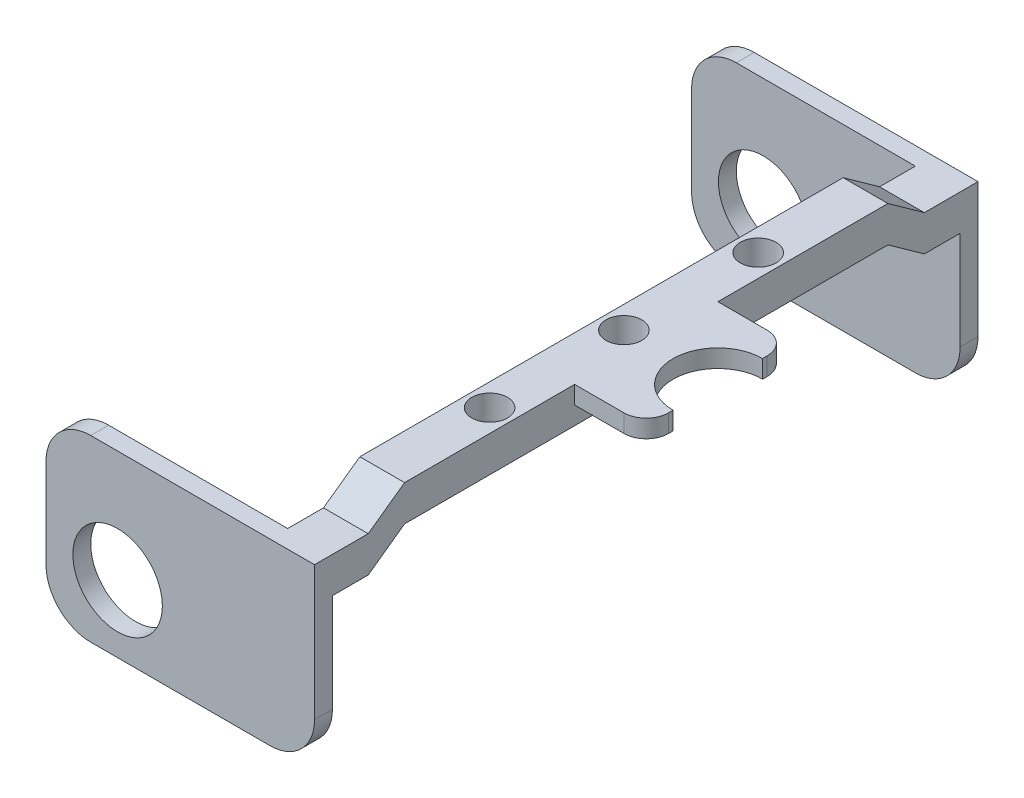
from build123d import *

# Parameters (mm, degrees)
SKETCH1_W            = 5
SKETCH1_H            = 54
BOSS_EXTRUDE1_DEPTH  = 4
SKETCH3_W            = 16
SKETCH3_H            = 16
BOSS_EXTRUDE2_DEPTH  = 4
SKETCH6_W            = 5
SKETCH6_H            = 4
BOSS_EXTRUDE5_DEPTH  = 5
SKETCH10_W           = 30
SKETCH10_H           = 20
BOSS_EXTRUDE9_DEPTH  = 6
CUT_EXTRUDE2_REACH   = 54.903
SKETCH7_R            = 2
CUT_EXTRUDE3_REACH   = 54.903
SKETCH4_R            = 5
SKETCH12_W           = 16
SKETCH12_H           = 16
CUT_EXTRUDE4_DEPTH   = 2
CUT_EXTRUDE5_DEPTH   = 4
CUT_EXTRUDE6_REACH   = 78.804
SKETCH14_R           = 5
FILLET1_R            = 5
FILLET1_OF_MIRROR2_R = 5
CUT_EXTRUDE7_REACH   = 54.903
FILLET2_R            = 2.5


with BuildPart() as part:
    # Sketch1 → Boss-Extrude1 (new body)
    with BuildSketch(Plane(origin=(0, 0, 0), x_dir=(1, 0, 0), z_dir=(0, 1, 0))):
        with Locations((-2.5, 0)):
            Rectangle(SKETCH1_W, SKETCH1_H)
    extrude(amount=BOSS_EXTRUDE1_DEPTH)

    # Sketch3 → Boss-Extrude2 (add)
    with BuildSketch(Plane(origin=(0, 0, 0), x_dir=(1, 0, 0), z_dir=(0, 1, 0))):
        with Locations((8, 0)):
            Rectangle(SKETCH3_W, SKETCH3_H)
    extrude(amount=BOSS_EXTRUDE2_DEPTH)

    # Sketch6 → Boss-Extrude5 (add, along a direction that is not the sketch's normal)
    with BuildSketch(Plane.XY.offset(27)):
        with Locations((-2.5, 2)):
            Rectangle(SKETCH6_W, SKETCH6_H)
    boss_extrude5 = extrude(amount=BOSS_EXTRUDE5_DEPTH, dir=(0, -0.5827823156195225, 0.8126283114691164))

    # Mirror1: Boss-Extrude5 across plane
    add(boss_extrude5.mirror(Plane.XY))

    # Sketch10 → Boss-Extrude9 (add)
    with BuildSketch(Plane.XY.offset(31.063141557)):
        with Locations((-15, -8.913911578)):
            Rectangle(SKETCH10_W, SKETCH10_H)
    boss_extrude9 = extrude(amount=BOSS_EXTRUDE9_DEPTH)

    # Sketch7 → Cut-Extrude2 (cut, up to next)
    with BuildSketch(Plane(origin=(0, 4, 0), x_dir=(1, 0, 0), z_dir=(0, 1, 0)), mode=Mode.PRIVATE) as cut_extrude2_sk1:
        with Locations(Location((-2.5, 0, 0), (0, 0, 270))):
            Circle(SKETCH7_R)
    cut_extrude2_tool1 = extrude(cut_extrude2_sk1.sketch, amount=-CUT_EXTRUDE2_REACH, mode=Mode.PRIVATE) & part.part
    # Sketch7 → Cut-Extrude2 (cut, up to next)
    with BuildSketch(Plane(origin=(0, 4, 0), x_dir=(1, 0, 0), z_dir=(0, 1, 0)), mode=Mode.PRIVATE) as cut_extrude2_sk2:
        with Locations(Location((-2.5, 15, 0), (0, 0, 270))):
            Circle(SKETCH7_R)
    cut_extrude2_tool2 = extrude(cut_extrude2_sk2.sketch, amount=-CUT_EXTRUDE2_REACH, mode=Mode.PRIVATE) & part.part
    # Sketch7 → Cut-Extrude2 (cut, up to next)
    with BuildSketch(Plane(origin=(0, 4, 0), x_dir=(1, 0, 0), z_dir=(0, 1, 0)), mode=Mode.PRIVATE) as cut_extrude2_sk3:
        with Locations(Location((-2.5, -15, 0), (0, 0, 270))):
            Circle(SKETCH7_R)
    cut_extrude2_tool3 = extrude(cut_extrude2_sk3.sketch, amount=-CUT_EXTRUDE2_REACH, mode=Mode.PRIVATE) & part.part
    add(cut_extrude2_tool1.solids().sort_by_distance((-2.5, 4, 0))[0], mode=Mode.SUBTRACT)
    add(cut_extrude2_tool2.solids().sort_by_distance((-2.5, 4, -15))[0], mode=Mode.SUBTRACT)
    add(cut_extrude2_tool3.solids().sort_by_distance((-2.5, 4, 15))[0], mode=Mode.SUBTRACT)

    # Sketch4 → Cut-Extrude3 (cut, up to next)
    with BuildSketch(Plane(origin=(0, 4, 0), x_dir=(1, 0, 0), z_dir=(0, 1, 0)), mode=Mode.PRIVATE) as cut_extrude3_sk1:
        with Locations(Location((8, 0, 0), (0, 0, 270))):
            Circle(SKETCH4_R)
    cut_extrude3_tool1 = extrude(cut_extrude3_sk1.sketch, amount=-CUT_EXTRUDE3_REACH, mode=Mode.PRIVATE) & part.part
    add(cut_extrude3_tool1.solids().sort_by_distance((8, 4, 0))[0], mode=Mode.SUBTRACT)

    # Sketch12 → Cut-Extrude4 (cut)
    with BuildSketch(Plane.XZ):
        with Locations((8, 0)):
            Rectangle(SKETCH12_W, SKETCH12_H)
    extrude(amount=-CUT_EXTRUDE4_DEPTH, mode=Mode.SUBTRACT)

    # Sketch13 → Cut-Extrude5 (cut)
    with BuildSketch(Plane(origin=(0, 0, 31.063141557), x_dir=(-1, 0, 0), z_dir=(0, 0, -1))):
        Polygon((30, 1.086088422), (5, 1.086088422), (5, -2.913911578), (0, -2.913911578), (0, -18.913911578), (30, -18.913911578), align=None)
    cut_extrude5 = extrude(amount=-CUT_EXTRUDE5_DEPTH, mode=Mode.SUBTRACT)

    # Sketch14 → Cut-Extrude6 (cut, up to next)
    with BuildSketch(Plane.XY.offset(37.063141557), mode=Mode.PRIVATE) as cut_extrude6_sk1:
        with Locations((-22, -11.413911578)):
            Circle(SKETCH14_R)
    cut_extrude6_tool1 = extrude(cut_extrude6_sk1.sketch, amount=-CUT_EXTRUDE6_REACH, mode=Mode.PRIVATE) & part.part
    cut_extrude6 = cut_extrude6_tool1.solids().sort_by_distance((-22, -11.413912, 37.063142))[0]
    add(cut_extrude6, mode=Mode.SUBTRACT)

    # Fillet1
    fillet1_edges = [part.edges().sort_by_distance(p)[0] for p in [
        (0, -18.913911578, 36.063141557),
        (-30, 1.086088422, 36.063141557),
        (-30, -18.913911578, 36.063141557),
    ]]
    fillet(fillet1_edges, radius=FILLET1_R)

    # Mirror2: Boss-Extrude9, Cut-Extrude5, Cut-Extrude6 across plane
    add(boss_extrude9.mirror(Plane.XY))
    add(cut_extrude5.mirror(Plane.XY), mode=Mode.SUBTRACT)
    add(cut_extrude6.mirror(Plane.XY), mode=Mode.SUBTRACT)

    # Fillet1 of Mirror2
    fillet1_of_mirror2_edges = [part.edges().sort_by_distance(p)[0] for p in [
        (0, -18.913911578, -36.063141557),
        (-30, 1.086088422, -36.063141557),
        (-30, -18.913911578, -36.063141557),
    ]]
    fillet(fillet1_of_mirror2_edges, radius=FILLET1_OF_MIRROR2_R)

    # Sketch15 → Cut-Extrude7 (cut, up to next)
    with BuildSketch(Plane(origin=(0, 4, 0), x_dir=(1, 0, 0), z_dir=(0, 1, 0)), mode=Mode.PRIVATE) as cut_extrude7_sk1:
        with BuildLine():
            Line((8, 5), (8, 8))
            Line((8, 8), (16, 8))
            Line((16, 8), (16, -8))
            Line((16, -8), (8, -8))
            Line((8, -8), (8, -5))
            ThreePointArc((8, -5), (13, 0), (8, 5))
        make_face()
    cut_extrude7_tool1 = extrude(cut_extrude7_sk1.sketch, amount=-CUT_EXTRUDE7_REACH, mode=Mode.PRIVATE) & part.part
    add(cut_extrude7_tool1.solids().sort_by_distance((8.178885, 4, -6.5))[0], mode=Mode.SUBTRACT)

    # Fillet2
    fillet2_edges = [part.edges().sort_by_distance(p)[0] for p in [
        (8, 3, 8),
        (8, 3, -8),
    ]]
    fillet(fillet2_edges, radius=FILLET2_R)


solid = part.part
